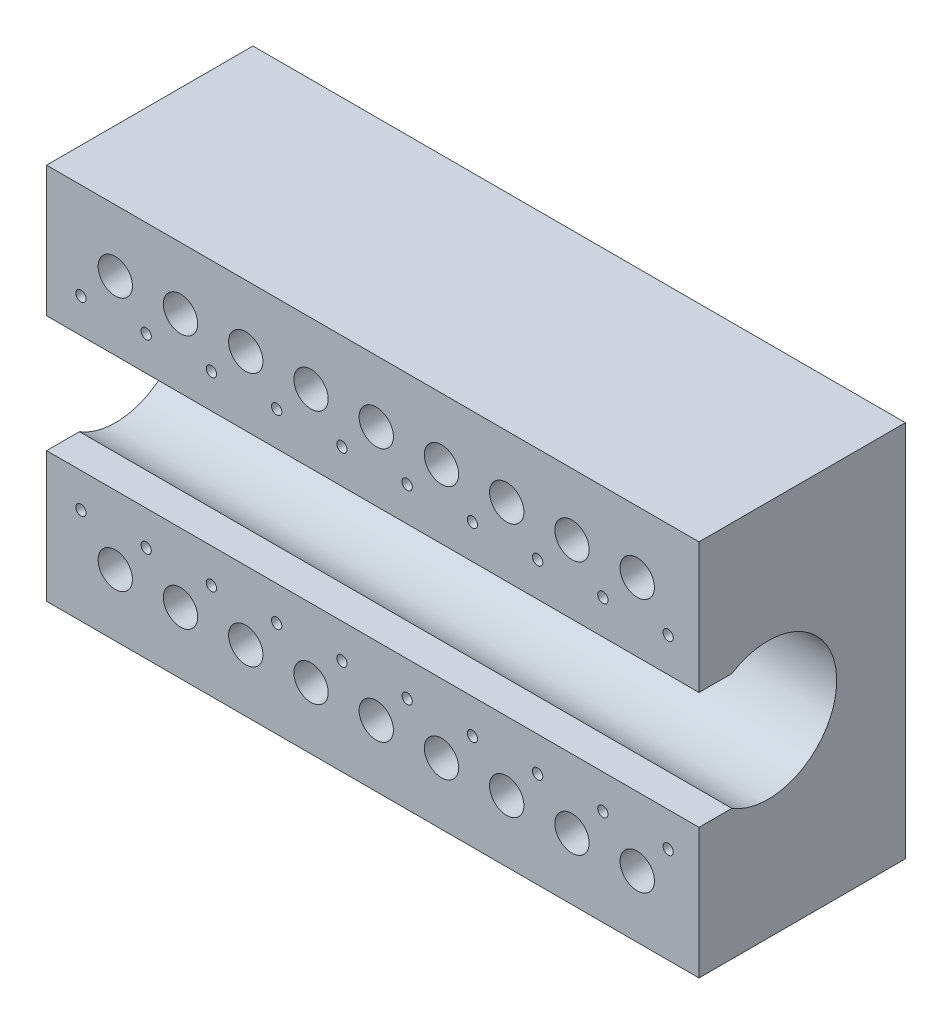
from build123d import *

# Parameters (mm, degrees)
SKETCH1_W           = 601
SKETCH1_H           = 1100
SKETCH1_R           = 200
BOSS_EXTRUDE1_DEPTH = 1900
SKETCH2_W           = 1900
SKETCH2_H           = 340
CUT_EXTRUDE1_DEPTH  = 300
SKETCH3_R           = 15
SKETCH3_R_2         = 50
CUT_EXTRUDE2_DEPTH  = 2277.225164609


with BuildPart() as part:
    # Sketch1 → Boss-Extrude1 (new body)
    with BuildSketch(Plane(origin=(0, 0, 0), x_dir=(0, 0, -1), z_dir=(1, 0, 0))):
        with Locations((300.5, 550)):
            Rectangle(SKETCH1_W, SKETCH1_H)
        with Locations(Location((201, 550, 0), (0, 0, 180))):
            Circle(SKETCH1_R, mode=Mode.SUBTRACT)
    extrude(amount=BOSS_EXTRUDE1_DEPTH)

    # Sketch2 → Cut-Extrude1 (cut)
    with BuildSketch(Plane.XY):
        with Locations((950, 550)):
            Rectangle(SKETCH2_W, SKETCH2_H)
    extrude(amount=-CUT_EXTRUDE1_DEPTH, mode=Mode.SUBTRACT)

    # Sketch3 → Cut-Extrude2 (cut, through all)
    with BuildSketch(Plane.XY):
        with Locations((100, 820)):
            Circle(SKETCH3_R)
        with Locations((200, 920)):
            Circle(SKETCH3_R_2)
        with Locations((290, 820)):
            Circle(SKETCH3_R)
        with Locations((480, 820)):
            Circle(SKETCH3_R)
        with Locations((670, 820)):
            Circle(SKETCH3_R)
        with Locations((860, 820)):
            Circle(SKETCH3_R)
        with Locations((1050, 820)):
            Circle(SKETCH3_R)
        with Locations((1240, 820)):
            Circle(SKETCH3_R)
        with Locations((1430, 820)):
            Circle(SKETCH3_R)
        with Locations((1620, 820)):
            Circle(SKETCH3_R)
        with Locations((1810, 820)):
            Circle(SKETCH3_R)
        with Locations((290, 280)):
            Circle(SKETCH3_R)
        with Locations((480, 280)):
            Circle(SKETCH3_R)
        with Locations((670, 280)):
            Circle(SKETCH3_R)
        with Locations((860, 280)):
            Circle(SKETCH3_R)
        with Locations((1050, 280)):
            Circle(SKETCH3_R)
        with Locations((1240, 280)):
            Circle(SKETCH3_R)
        with Locations((1430, 280)):
            Circle(SKETCH3_R)
        with Locations((1620, 280)):
            Circle(SKETCH3_R)
        with Locations((1810, 280)):
            Circle(SKETCH3_R)
        with Locations((100, 280)):
            Circle(SKETCH3_R)
        with Locations((390, 920)):
            Circle(SKETCH3_R_2)
        with Locations((580, 920)):
            Circle(SKETCH3_R_2)
        with Locations((770, 920)):
            Circle(SKETCH3_R_2)
        with Locations((960, 920)):
            Circle(SKETCH3_R_2)
        with Locations((1150, 920)):
            Circle(SKETCH3_R_2)
        with Locations((1340, 920)):
            Circle(SKETCH3_R_2)
        with Locations((1530, 920)):
            Circle(SKETCH3_R_2)
        with Locations((1720, 920)):
            Circle(SKETCH3_R_2)
        with Locations((390, 180)):
            Circle(SKETCH3_R_2)
        with Locations((580, 180)):
            Circle(SKETCH3_R_2)
        with Locations((770, 180)):
            Circle(SKETCH3_R_2)
        with Locations((960, 180)):
            Circle(SKETCH3_R_2)
        with Locations((1150, 180)):
            Circle(SKETCH3_R_2)
        with Locations((1340, 180)):
            Circle(SKETCH3_R_2)
        with Locations((1530, 180)):
            Circle(SKETCH3_R_2)
        with Locations((1720, 180)):
            Circle(SKETCH3_R_2)
        with Locations((200, 180)):
            Circle(SKETCH3_R_2)
    extrude(amount=-CUT_EXTRUDE2_DEPTH, mode=Mode.SUBTRACT)


solid = part.part
